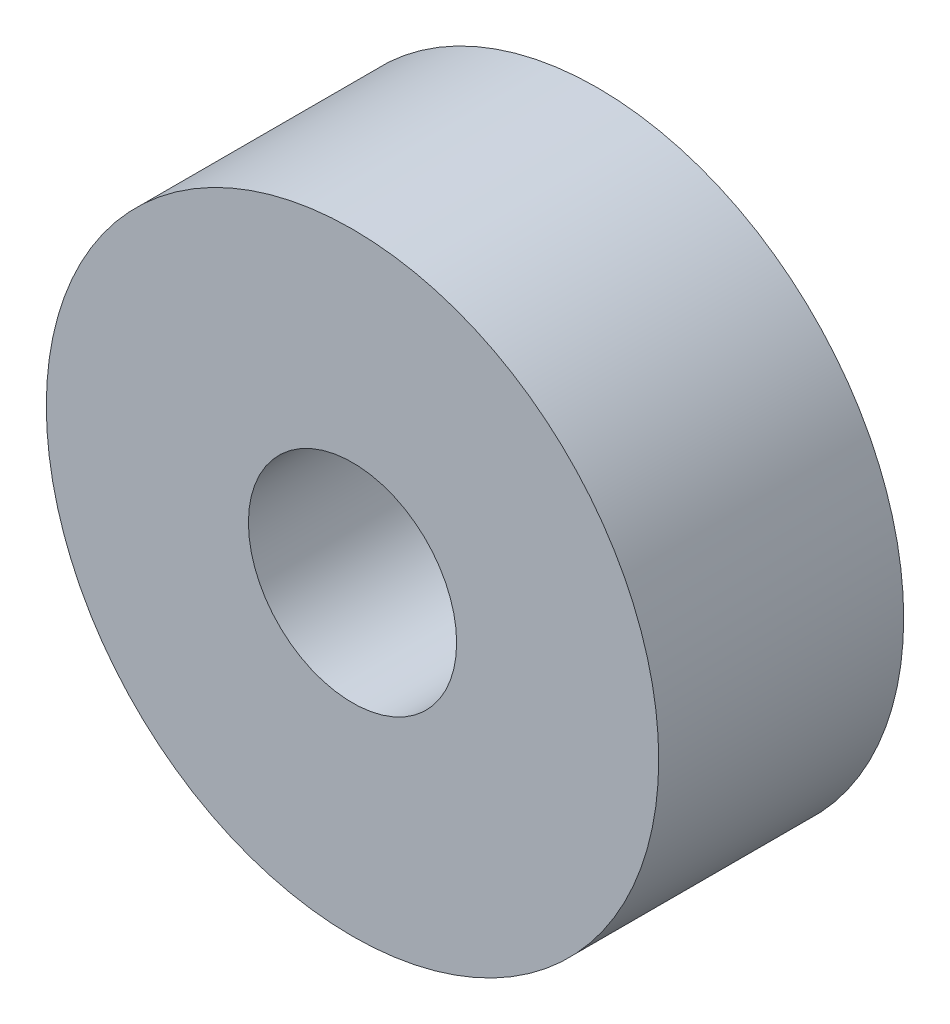
from build123d import *

# Parameters (mm, degrees)
SKETCH1_R           = 5
SKETCH1_R_2         = 1.7
BOSS_EXTRUDE1_DEPTH = 4


with BuildPart() as part:
    # Sketch1 → Boss-Extrude1 (new body)
    with BuildSketch(Plane.XY):
        Circle(SKETCH1_R)
        Circle(SKETCH1_R_2, mode=Mode.SUBTRACT)
    extrude(amount=BOSS_EXTRUDE1_DEPTH)


solid = part.part
